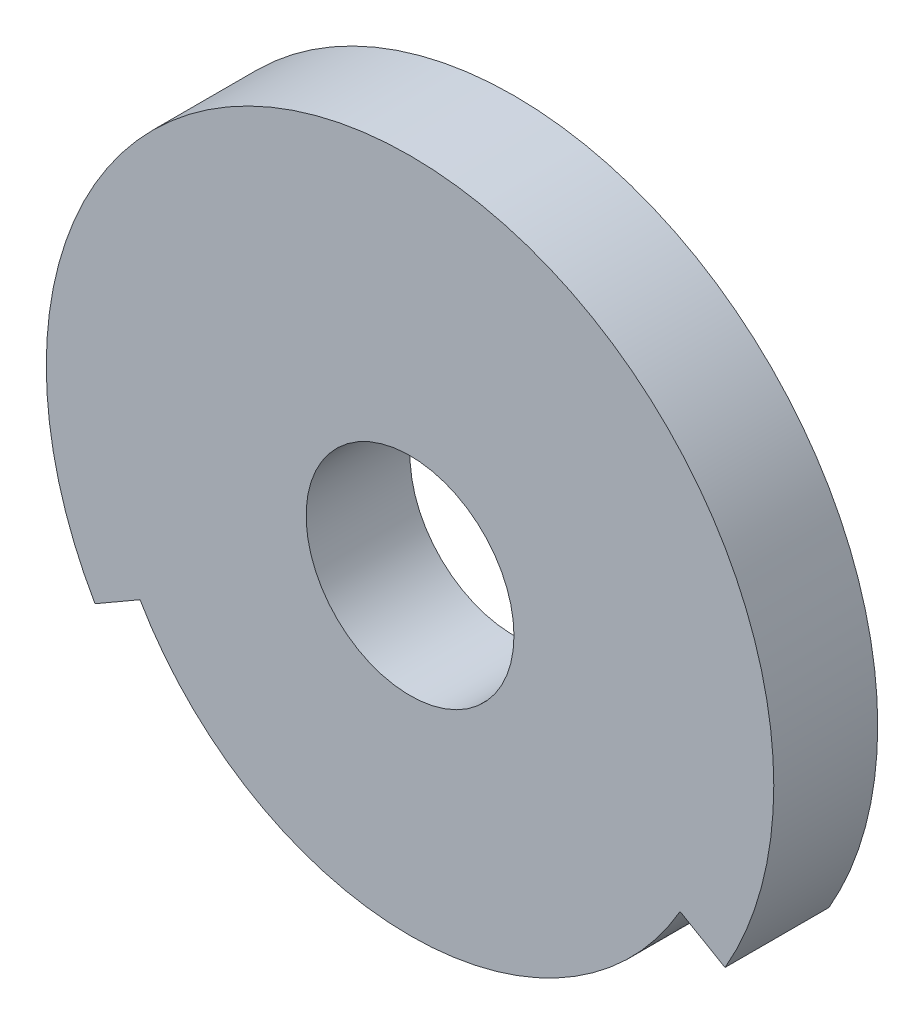
from build123d import *

# Parameters (mm, degrees)
SKETCH1_R           = 1
BOSS_EXTRUDE1_DEPTH = 1


with BuildPart() as part:
    # Sketch1 → Boss-Extrude1 (new body)
    with BuildSketch(Plane(origin=(0, 0, 0), x_dir=(-1, 0, 0), z_dir=(0, 0, -1))):
        with BuildLine():
            Line((-3.031088913, -1.75), (-2.598076211, -1.5))
            ThreePointArc((-2.598076211, -1.5), (0, -3), (2.598076211, -1.5))
            Line((2.598076211, -1.5), (3.031088913, -1.75))
            ThreePointArc((3.031088913, -1.75), (0, 3.5), (-3.031088913, -1.75))
        make_face()
        with Locations(Location((0, 0, 0), (0, 0, 180))):
            Circle(SKETCH1_R, mode=Mode.SUBTRACT)
    extrude(amount=-BOSS_EXTRUDE1_DEPTH)


solid = part.part
